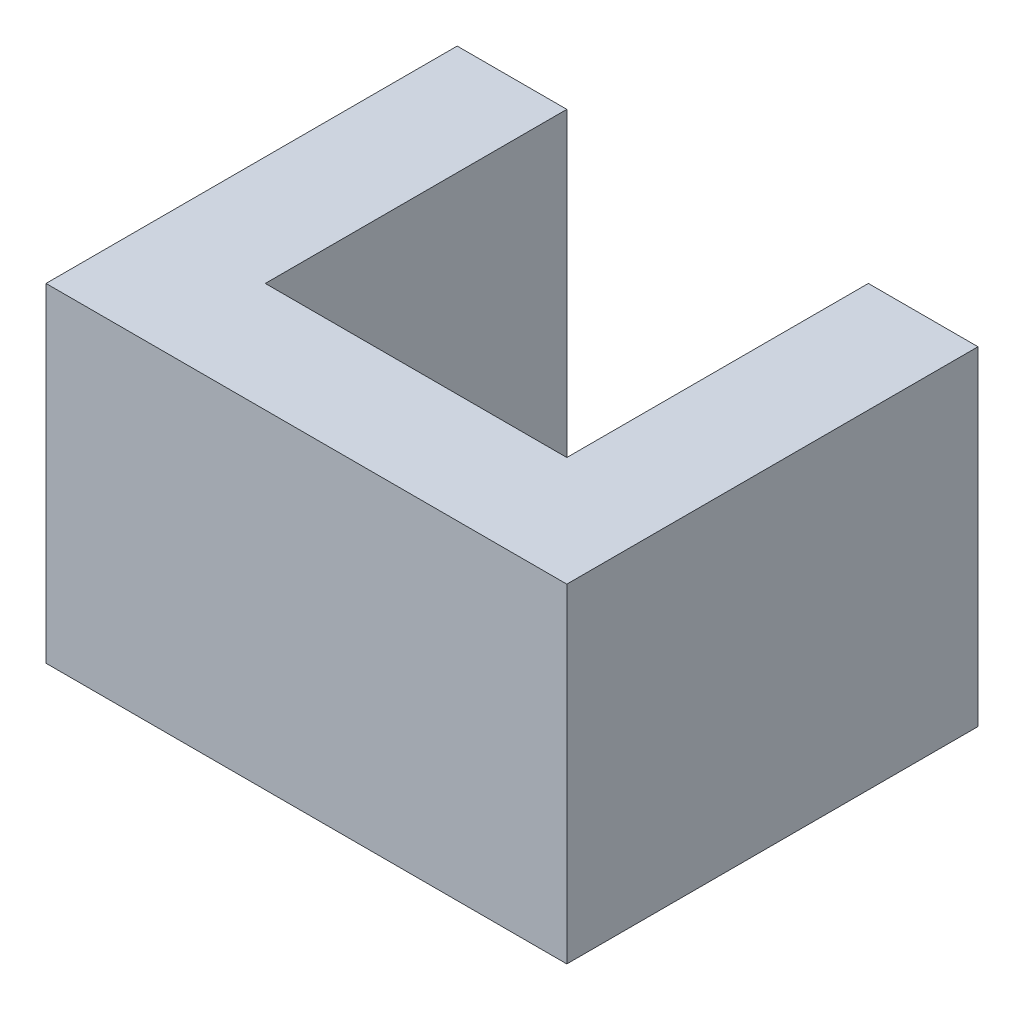
from build123d import *

# Parameters (mm, degrees)
BOSS_EXTRUDE1_DEPTH = 12


with BuildPart() as part:
    # Sketch1 → Boss-Extrude1 (new body)
    with BuildSketch(Plane(origin=(0, 0, 0), x_dir=(1, 0, 0), z_dir=(0, 1, 0))):
        Polygon((-9.5, 0), (9.5, 0), (9.5, 15), (5.5, 15), (5.5, 4), (-5.5, 4), (-5.5, 15), (-9.5, 15), align=None)
    extrude(amount=BOSS_EXTRUDE1_DEPTH)


solid = part.part
